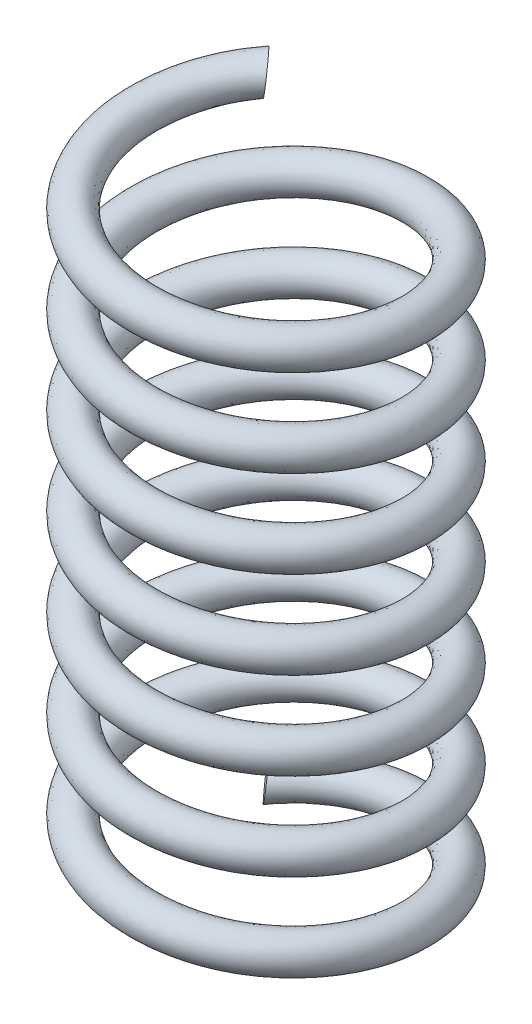
from build123d import *

# Parameters (mm, degrees)
SWEEP1_PITCH       = 1.487714286
SWEEP1_HEIGHT      = 10.414
SWEEP1_RADIUS      = 2.3241
SWEEP1_START_ANGLE = -135
SKETCH2_R          = 0.3175


with BuildPart() as part:
    # Sweep1: sweep along a helix
    with BuildLine() as sweep1_path:
        add(Helix(SWEEP1_PITCH, SWEEP1_HEIGHT, SWEEP1_RADIUS, center=(0, 0, 0), direction=(0, 1, 0), lefthand=True, mode=Mode.PRIVATE).rotate(Axis((0, 0, 0), (0, 1, 0)), SWEEP1_START_ANGLE))
    # Sketch2 → Sweep1 (sweep)
    with BuildSketch(Plane(origin=(-1.64338687, 10.414, -1.64338687), x_dir=(-0.696310209213281, -0.10007879162063817, -0.7107294337602107), z_dir=(0.70346545214169, 0.10135440437569695, -0.7034654521415644))):
        with Locations((-4.547345281, -1.219185237)):
            Circle(SKETCH2_R)
    sweep(path=sweep1_path.line, is_frenet=True)


solid = part.part
